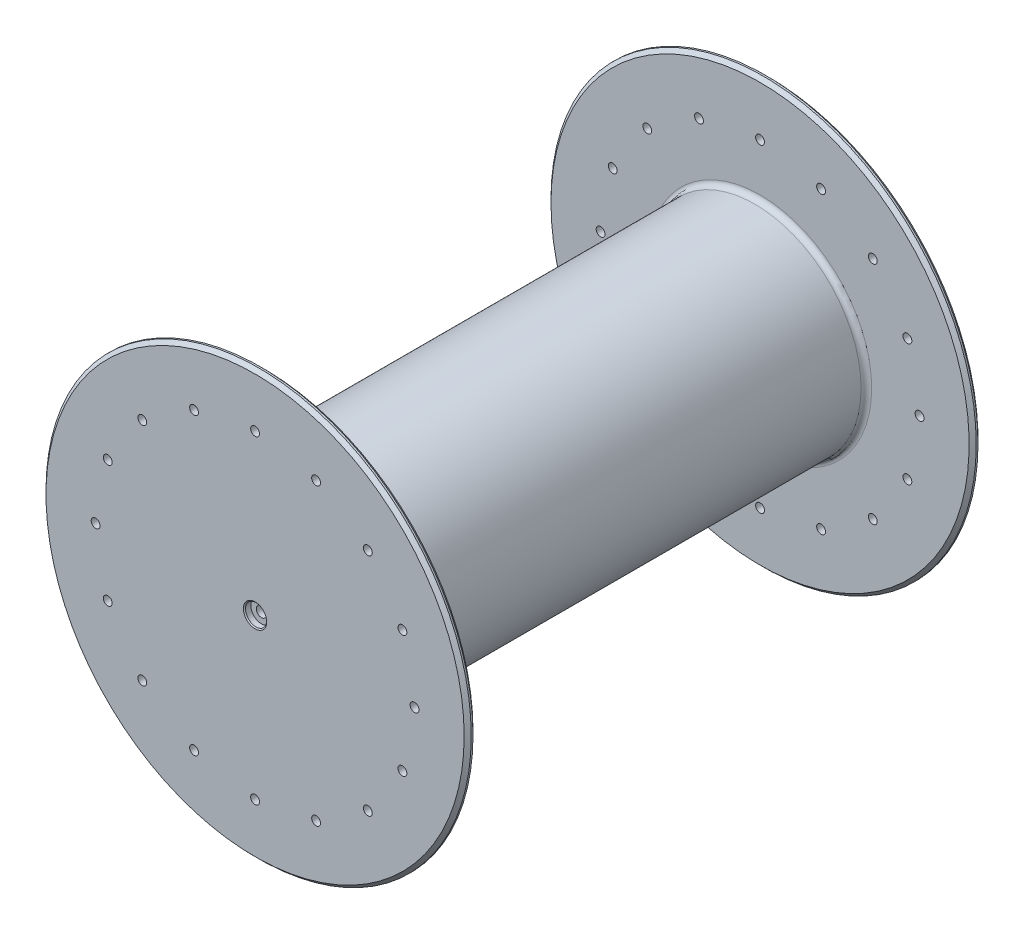
from build123d import *

# Parameters (mm, degrees)
SKETCH1_R                = 60
BOSS_EXTRUDE1_DEPTH      = 140
SKETCH2_R                = 120
BOSS_EXTRUDE2_DEPTH      = 5
CHAMFER1_SIZE            = 2
SKETCH3_R                = 2.5
CUT_EXTRUDE1_DEPTH       = 332.700165812
CIRPATTERN1_COUNT        = 16
FILLET1_R                = 3
MIRROR1_COPY_1_SKETCH_R  = 2.5
MIRROR1_COPY_1_DEPTH     = 332.700165812
MIRROR1_COPY_2_SKETCH_R  = 2.5
MIRROR1_COPY_2_DEPTH     = 332.700165812
MIRROR1_COPY_3_SKETCH_R  = 2.5
MIRROR1_COPY_3_DEPTH     = 332.700165812
MIRROR1_COPY_4_SKETCH_R  = 2.5
MIRROR1_COPY_4_DEPTH     = 332.700165812
MIRROR1_COPY_5_SKETCH_R  = 2.5
MIRROR1_COPY_5_DEPTH     = 332.700165812
MIRROR1_COPY_6_SKETCH_R  = 2.5
MIRROR1_COPY_6_DEPTH     = 332.700165812
MIRROR1_COPY_7_SKETCH_R  = 2.5
MIRROR1_COPY_7_DEPTH     = 332.700165812
MIRROR1_COPY_8_SKETCH_R  = 2.5
MIRROR1_COPY_8_DEPTH     = 332.700165812
MIRROR1_COPY_9_SKETCH_R  = 2.5
MIRROR1_COPY_9_DEPTH     = 332.700165812
MIRROR1_COPY_10_SKETCH_R = 2.5
MIRROR1_COPY_10_DEPTH    = 332.700165812
MIRROR1_COPY_11_SKETCH_R = 2.5
MIRROR1_COPY_11_DEPTH    = 332.700165812
MIRROR1_COPY_12_SKETCH_R = 2.5
MIRROR1_COPY_12_DEPTH    = 332.700165812
MIRROR1_COPY_13_SKETCH_R = 2.5
MIRROR1_COPY_13_DEPTH    = 332.700165812
MIRROR1_COPY_14_SKETCH_R = 2.5
MIRROR1_COPY_14_DEPTH    = 332.700165812
MIRROR1_COPY_15_SKETCH_R = 2.5
MIRROR1_COPY_15_DEPTH    = 332.700165812
CHAMFER1_OF_MIRROR1_SIZE = 2
FILLET1_OF_MIRROR1_R     = 3


with BuildPart() as part:
    # Sketch1 → Boss-Extrude1 (new, symmetric)
    with BuildSketch(Plane.XY):
        Circle(SKETCH1_R)
    extrude(amount=BOSS_EXTRUDE1_DEPTH, both=True)

    # Sketch2 → Boss-Extrude2 (add)
    with BuildSketch(Plane.XY.offset(140)):
        Circle(SKETCH2_R)
    boss_extrude2 = extrude(amount=BOSS_EXTRUDE2_DEPTH)

    # Chamfer1
    chamfer1_edges = [part.edges().sort_by_distance(p)[0] for p in [
        (-120, 0, 140),
        (-120, 0, 145),
    ]]
    chamfer(chamfer1_edges, length=CHAMFER1_SIZE)

    # Sketch3 → Cut-Extrude1 (cut, through all)
    with BuildSketch(Plane.XY.offset(145)):
        with Locations((0, 90)):
            Circle(SKETCH3_R)
    cut_extrude1 = extrude(amount=-CUT_EXTRUDE1_DEPTH, mode=Mode.SUBTRACT)

    # CirPattern1: Cut-Extrude1 ×16 about axis
    cirpattern1_axis = Axis((0, 0, 140), (0, 0, 1))
    for i in range(1, CIRPATTERN1_COUNT):
        add(cut_extrude1.rotate(cirpattern1_axis, i * 360 / CIRPATTERN1_COUNT), mode=Mode.SUBTRACT)

    # Fillet1
    fillet1_edges = [part.edges().sort_by_distance(p)[0] for p in [
        (-60, 0, 140),
    ]]
    fillet(fillet1_edges, radius=FILLET1_R)

    # Sketch7 → CBORE for #12 Binding Head Machine Screw1 (revolve, cut)
    with BuildSketch(Plane(origin=(0, 0, 145), x_dir=(0, -1, 0), z_dir=(1, 0, 0))):
        Polygon((0, 0), (0, 290), (2.8956, 290), (2.8956, 3.5814), (5.95376, 3.5814), (5.95376, 0.532828266), (6.58876, 0), align=None)
    cbore_for_12_binding_head_machine_screw = revolve(axis=Axis((0, 0, 151.35), (0, 0, -1)), mode=Mode.SUBTRACT)

    # Mirror1: Boss-Extrude2, Cut-Extrude1, CBORE for #12 Binding Head Machine Screw1 across plane
    add(boss_extrude2.mirror(Plane.XY))
    add(cut_extrude1.mirror(Plane.XY), mode=Mode.SUBTRACT)
    add(cbore_for_12_binding_head_machine_screw.mirror(Plane.XY), mode=Mode.SUBTRACT)

    # Mirror1 copy 1 sketch → Mirror1 copy 1 (cut, through all)
    with BuildSketch(Plane(origin=(0, 0, -145), x_dir=(0.9238795325112867, 0.3826834323650898, 0), z_dir=(0, 0, -1))):
        with Locations((0, -90)):
            Circle(MIRROR1_COPY_1_SKETCH_R)
    extrude(amount=-MIRROR1_COPY_1_DEPTH, mode=Mode.SUBTRACT)

    # Mirror1 copy 2 sketch → Mirror1 copy 2 (cut, through all)
    with BuildSketch(Plane(origin=(0, 0, -145), x_dir=(0.7071067811865476, 0.7071067811865475, 0), z_dir=(0, 0, -1))):
        with Locations((0, -90)):
            Circle(MIRROR1_COPY_2_SKETCH_R)
    extrude(amount=-MIRROR1_COPY_2_DEPTH, mode=Mode.SUBTRACT)

    # Mirror1 copy 3 sketch → Mirror1 copy 3 (cut, through all)
    with BuildSketch(Plane(origin=(0, 0, -145), x_dir=(0.38268343236508984, 0.9238795325112867, 0), z_dir=(0, 0, -1))):
        with Locations((0, -90)):
            Circle(MIRROR1_COPY_3_SKETCH_R)
    extrude(amount=-MIRROR1_COPY_3_DEPTH, mode=Mode.SUBTRACT)

    # Mirror1 copy 4 sketch → Mirror1 copy 4 (cut, through all)
    with BuildSketch(Plane.YX.offset(145)):
        with Locations((0, -90)):
            Circle(MIRROR1_COPY_4_SKETCH_R)
    extrude(amount=-MIRROR1_COPY_4_DEPTH, mode=Mode.SUBTRACT)

    # Mirror1 copy 5 sketch → Mirror1 copy 5 (cut, through all)
    with BuildSketch(Plane(origin=(0, 0, -145), x_dir=(-0.3826834323650897, 0.9238795325112867, 0), z_dir=(0, 0, -1))):
        with Locations((0, -90)):
            Circle(MIRROR1_COPY_5_SKETCH_R)
    extrude(amount=-MIRROR1_COPY_5_DEPTH, mode=Mode.SUBTRACT)

    # Mirror1 copy 6 sketch → Mirror1 copy 6 (cut, through all)
    with BuildSketch(Plane(origin=(0, 0, -145), x_dir=(-0.7071067811865475, 0.7071067811865476, 0), z_dir=(0, 0, -1))):
        with Locations((0, -90)):
            Circle(MIRROR1_COPY_6_SKETCH_R)
    extrude(amount=-MIRROR1_COPY_6_DEPTH, mode=Mode.SUBTRACT)

    # Mirror1 copy 7 sketch → Mirror1 copy 7 (cut, through all)
    with BuildSketch(Plane(origin=(0, 0, -145), x_dir=(-0.9238795325112867, 0.3826834323650899, 0), z_dir=(0, 0, -1))):
        with Locations((0, -90)):
            Circle(MIRROR1_COPY_7_SKETCH_R)
    extrude(amount=-MIRROR1_COPY_7_DEPTH, mode=Mode.SUBTRACT)

    # Mirror1 copy 8 sketch → Mirror1 copy 8 (cut, through all)
    with BuildSketch(Plane(origin=(0, 0, -145), x_dir=(-1, 0, 0), z_dir=(0, 0, -1))):
        with Locations((0, -90)):
            Circle(MIRROR1_COPY_8_SKETCH_R)
    extrude(amount=-MIRROR1_COPY_8_DEPTH, mode=Mode.SUBTRACT)

    # Mirror1 copy 9 sketch → Mirror1 copy 9 (cut, through all)
    with BuildSketch(Plane(origin=(0, 0, -145), x_dir=(-0.9238795325112868, -0.38268343236508967, 0), z_dir=(0, 0, -1))):
        with Locations((0, -90)):
            Circle(MIRROR1_COPY_9_SKETCH_R)
    extrude(amount=-MIRROR1_COPY_9_DEPTH, mode=Mode.SUBTRACT)

    # Mirror1 copy 10 sketch → Mirror1 copy 10 (cut, through all)
    with BuildSketch(Plane(origin=(0, 0, -145), x_dir=(-0.7071067811865477, -0.7071067811865475, 0), z_dir=(0, 0, -1))):
        with Locations((0, -90)):
            Circle(MIRROR1_COPY_10_SKETCH_R)
    extrude(amount=-MIRROR1_COPY_10_DEPTH, mode=Mode.SUBTRACT)

    # Mirror1 copy 11 sketch → Mirror1 copy 11 (cut, through all)
    with BuildSketch(Plane(origin=(0, 0, -145), x_dir=(-0.3826834323650895, -0.9238795325112868, 0), z_dir=(0, 0, -1))):
        with Locations((0, -90)):
            Circle(MIRROR1_COPY_11_SKETCH_R)
    extrude(amount=-MIRROR1_COPY_11_DEPTH, mode=Mode.SUBTRACT)

    # Mirror1 copy 12 sketch → Mirror1 copy 12 (cut, through all)
    with BuildSketch(Plane(origin=(0, 0, -145), x_dir=(0, -1, 0), z_dir=(0, 0, -1))):
        with Locations((0, -90)):
            Circle(MIRROR1_COPY_12_SKETCH_R)
    extrude(amount=-MIRROR1_COPY_12_DEPTH, mode=Mode.SUBTRACT)

    # Mirror1 copy 13 sketch → Mirror1 copy 13 (cut, through all)
    with BuildSketch(Plane(origin=(0, 0, -145), x_dir=(0.38268343236509, -0.9238795325112866, 0), z_dir=(0, 0, -1))):
        with Locations((0, -90)):
            Circle(MIRROR1_COPY_13_SKETCH_R)
    extrude(amount=-MIRROR1_COPY_13_DEPTH, mode=Mode.SUBTRACT)

    # Mirror1 copy 14 sketch → Mirror1 copy 14 (cut, through all)
    with BuildSketch(Plane(origin=(0, 0, -145), x_dir=(0.7071067811865474, -0.7071067811865477, 0), z_dir=(0, 0, -1))):
        with Locations((0, -90)):
            Circle(MIRROR1_COPY_14_SKETCH_R)
    extrude(amount=-MIRROR1_COPY_14_DEPTH, mode=Mode.SUBTRACT)

    # Mirror1 copy 15 sketch → Mirror1 copy 15 (cut, through all)
    with BuildSketch(Plane(origin=(0, 0, -145), x_dir=(0.9238795325112868, -0.38268343236508956, 0), z_dir=(0, 0, -1))):
        with Locations((0, -90)):
            Circle(MIRROR1_COPY_15_SKETCH_R)
    extrude(amount=-MIRROR1_COPY_15_DEPTH, mode=Mode.SUBTRACT)

    # Chamfer1 of Mirror1
    chamfer1_of_mirror1_edges = [part.edges().sort_by_distance(p)[0] for p in [
        (-120, 0, -140),
        (-120, 0, -145),
    ]]
    chamfer(chamfer1_of_mirror1_edges, length=CHAMFER1_OF_MIRROR1_SIZE)

    # Fillet1 of Mirror1
    fillet1_of_mirror1_edges = [part.edges().sort_by_distance(p)[0] for p in [
        (-60, 0, -140),
    ]]
    fillet(fillet1_of_mirror1_edges, radius=FILLET1_OF_MIRROR1_R)


solid = part.part
